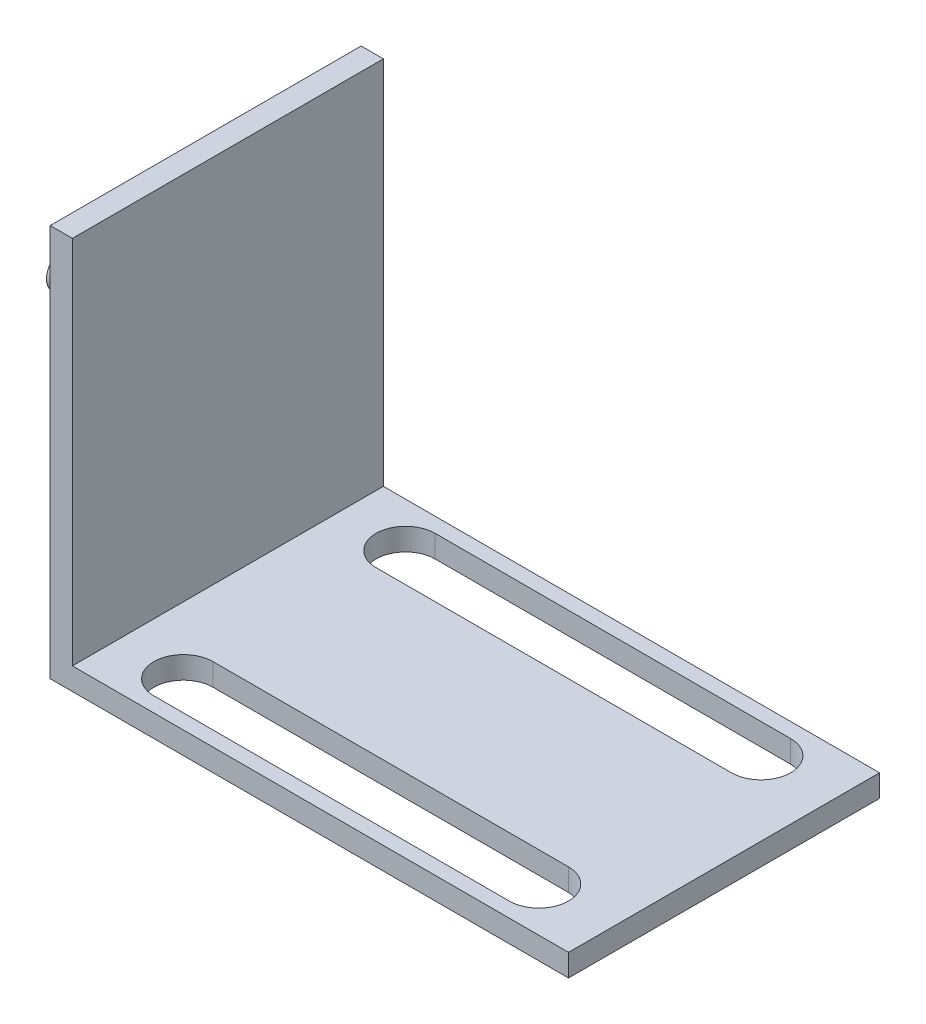
from build123d import *

# Parameters (mm, degrees)
EXTRUDE_1_DEPTH      = 21
EXTRUDE_1_DEPTH_BACK = 21
CUT_EXTRUDE_1_REACH  = 90.549
SKETCH_3_R           = 2.5
EXTRUDE_2_DEPTH      = 19


with BuildPart() as part:
    # 草图1 → 凸台-拉伸1 (new, two sides: drawn at the far end of the back side and taken through both)
    with BuildSketch(Plane.XY.offset(-EXTRUDE_1_DEPTH_BACK)):
        Polygon((0, 53), (0, 0), (70, 0), (70, 3), (3, 3), (3, 53), align=None)
    extrude(amount=EXTRUDE_1_DEPTH + EXTRUDE_1_DEPTH_BACK)

    # 草图2 → 切除-拉伸1 (cut, up to next)
    with BuildSketch(Plane(origin=(0, 3, 0), x_dir=(1, 0, 0), z_dir=(0, 1, 0)), mode=Mode.PRIVATE) as cut_extrude_1_sk1:
        with BuildLine():
            Line((12, -11), (60, -11))
            ThreePointArc((60, -11), (64, -15), (60, -19))
            Line((60, -19), (12, -19))
            ThreePointArc((12, -19), (8, -15), (12, -11))
        make_face()
    cut_extrude_1_tool1 = extrude(cut_extrude_1_sk1.sketch, amount=-CUT_EXTRUDE_1_REACH, mode=Mode.PRIVATE) & part.part
    # 草图2 → 切除-拉伸1 (cut, up to next)
    with BuildSketch(Plane(origin=(0, 3, 0), x_dir=(1, 0, 0), z_dir=(0, 1, 0)), mode=Mode.PRIVATE) as cut_extrude_1_sk2:
        with BuildLine():
            Line((12, 11), (60, 11))
            ThreePointArc((60, 11), (64, 15), (60, 19))
            Line((60, 19), (12, 19))
            ThreePointArc((12, 19), (8, 15), (12, 11))
        make_face()
    cut_extrude_1_tool2 = extrude(cut_extrude_1_sk2.sketch, amount=-CUT_EXTRUDE_1_REACH, mode=Mode.PRIVATE) & part.part
    add(cut_extrude_1_tool1.solids().sort_by_distance((36, 3, 15))[0], mode=Mode.SUBTRACT)
    add(cut_extrude_1_tool2.solids().sort_by_distance((36, 3, -15))[0], mode=Mode.SUBTRACT)

    # 草图3 → 凸台-拉伸2 (add)
    with BuildSketch(Plane.ZY):
        with Locations((0, 28)):
            Circle(SKETCH_3_R)
    extrude(amount=EXTRUDE_2_DEPTH)


solid = part.part
